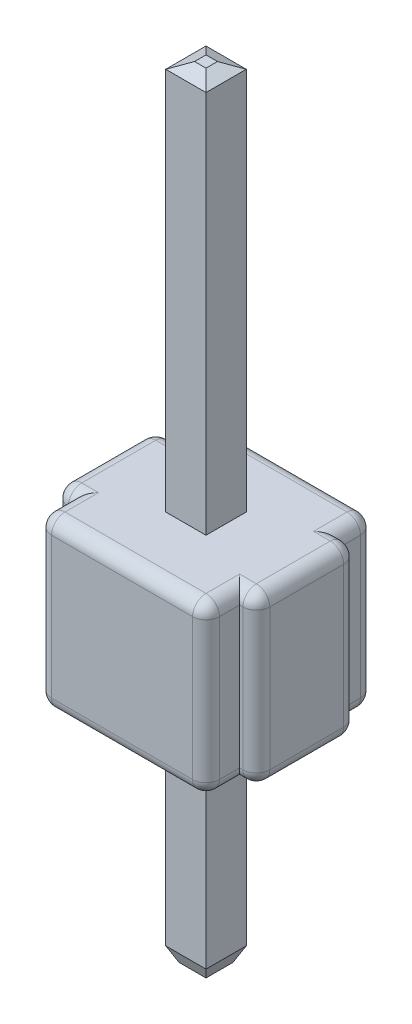
from build123d import *
from OCP.BRepFilletAPI import BRepFilletAPI_MakeChamfer

# Parameters (mm, degrees)
BOSS_EXTRUDE1_DEPTH = 2.5
FILLET1_R           = 0.2
SKETCH2_W           = 0.6
SKETCH2_H           = 0.6
BOSS_EXTRUDE2_DEPTH = 5.81
CHAMFER1_SIZE       = 0.1
CHAMFER1_SIZE2      = 0.214450692


with BuildPart() as part:
    # Sketch1 → Boss-Extrude1 (new body)
    with BuildSketch(Plane(origin=(0, 0, 0), x_dir=(1, 0, 0), z_dir=(0, 1, 0))):
        Polygon((1.25, 0.75), (1.5, 0.75), (1.5, -0.75), (1.25, -0.75), (1.25, -1.25), (-1.25, -1.25), (-1.25, -0.75), (-1.5, -0.75), (-1.5, 0.75), (-1.25, 0.75), (-1.25, 1.25), (1.25, 1.25), align=None)
    extrude(amount=BOSS_EXTRUDE1_DEPTH)

    # Fillet1
    fillet1_edges = [part.edges().sort_by_distance(p)[0] for p in [
        (-1.5, 2.5, 0),
        (0, 0, -1.25),
        (1.25, 0, -1),
        (1.375, 0, -0.75),
        (1.5, 0, 0),
        (1.375, 0, 0.75),
        (1.25, 0, 1),
        (-1.375, 2.5, 0.75),
        (0, 0, 1.25),
        (-1.25, 0, 1),
        (-1.375, 0, 0.75),
        (-1.5, 0, 0),
        (-1.375, 0, -0.75),
        (-1.25, 0, -1),
        (-1.25, 2.5, 1),
        (0, 2.5, 1.25),
        (-1.25, 1.25, -1.25),
        (1.25, 1.25, -1.25),
        (1.5, 1.25, -0.75),
        (1.5, 1.25, 0.75),
        (1.25, 1.25, 1.25),
        (-1.25, 1.25, 1.25),
        (-1.5, 1.25, 0.75),
        (-1.5, 1.25, -0.75),
        (1.25, 2.5, 1),
        (1.375, 2.5, 0.75),
        (1.5, 2.5, 0),
        (1.375, 2.5, -0.75),
        (1.25, 2.5, -1),
        (0, 2.5, -1.25),
        (-1.25, 2.5, -1),
        (-1.375, 2.5, -0.75),
    ]]
    fillet(fillet1_edges, radius=FILLET1_R)

    # Sketch2 → Boss-Extrude2 (add, symmetric)
    with BuildSketch(Plane(origin=(0, 2.5, 0), x_dir=(1, 0, 0), z_dir=(0, 1, 0))):
        Rectangle(SKETCH2_W, SKETCH2_H)
    extrude(amount=BOSS_EXTRUDE2_DEPTH, both=True)

    # Chamfer1: one chamfer whose edges measure the first distance from different faces: ONE call of the kernel's chamfer builder (chamfer() names one face for all edges)
    chamfer1_edges_1 = [part.edges().sort_by_distance(p)[0] for p in [
        (-0.3, -3.31, 0),
        (0, -3.31, 0.3),
        (0.3, -3.31, 0),
        (0, -3.31, -0.3),
    ]]
    chamfer1_side_1 = [part.faces().sort_by_distance(p)[0] for p in [
        (0, -3.31, 0),
    ]]
    chamfer1_edges_2 = [part.edges().sort_by_distance(p)[0] for p in [
        (-0.3, 8.31, 0),
    ]]
    chamfer1_side_2 = [part.faces().sort_by_distance(p)[0] for p in [
        (-0.3, 5.405, 0),
    ]]
    chamfer1_edges_3 = [part.edges().sort_by_distance(p)[0] for p in [
        (0, 8.31, 0.3),
    ]]
    chamfer1_side_3 = [part.faces().sort_by_distance(p)[0] for p in [
        (0, 5.405, 0.3),
    ]]
    chamfer1_edges_4 = [part.edges().sort_by_distance(p)[0] for p in [
        (0.3, 8.31, 0),
    ]]
    chamfer1_side_4 = [part.faces().sort_by_distance(p)[0] for p in [
        (0.3, 5.405, 0),
    ]]
    chamfer1_edges_5 = [part.edges().sort_by_distance(p)[0] for p in [
        (0, 8.31, -0.3),
    ]]
    chamfer1_side_5 = [part.faces().sort_by_distance(p)[0] for p in [
        (0, 5.405, -0.3),
    ]]
    chamfer1 = BRepFilletAPI_MakeChamfer(part.part.solid().wrapped)
    for e in chamfer1_edges_1:
        chamfer1.Add(CHAMFER1_SIZE, CHAMFER1_SIZE2, e.wrapped, chamfer1_side_1[0].wrapped)  # the first distance lies on this face
    for e in chamfer1_edges_2:
        chamfer1.Add(CHAMFER1_SIZE, CHAMFER1_SIZE2, e.wrapped, chamfer1_side_2[0].wrapped)  # the first distance lies on this face
    for e in chamfer1_edges_3:
        chamfer1.Add(CHAMFER1_SIZE, CHAMFER1_SIZE2, e.wrapped, chamfer1_side_3[0].wrapped)  # the first distance lies on this face
    for e in chamfer1_edges_4:
        chamfer1.Add(CHAMFER1_SIZE, CHAMFER1_SIZE2, e.wrapped, chamfer1_side_4[0].wrapped)  # the first distance lies on this face
    for e in chamfer1_edges_5:
        chamfer1.Add(CHAMFER1_SIZE, CHAMFER1_SIZE2, e.wrapped, chamfer1_side_5[0].wrapped)  # the first distance lies on this face
    add(Compound.cast(chamfer1.Shape()), mode=Mode.REPLACE)


solid = part.part
